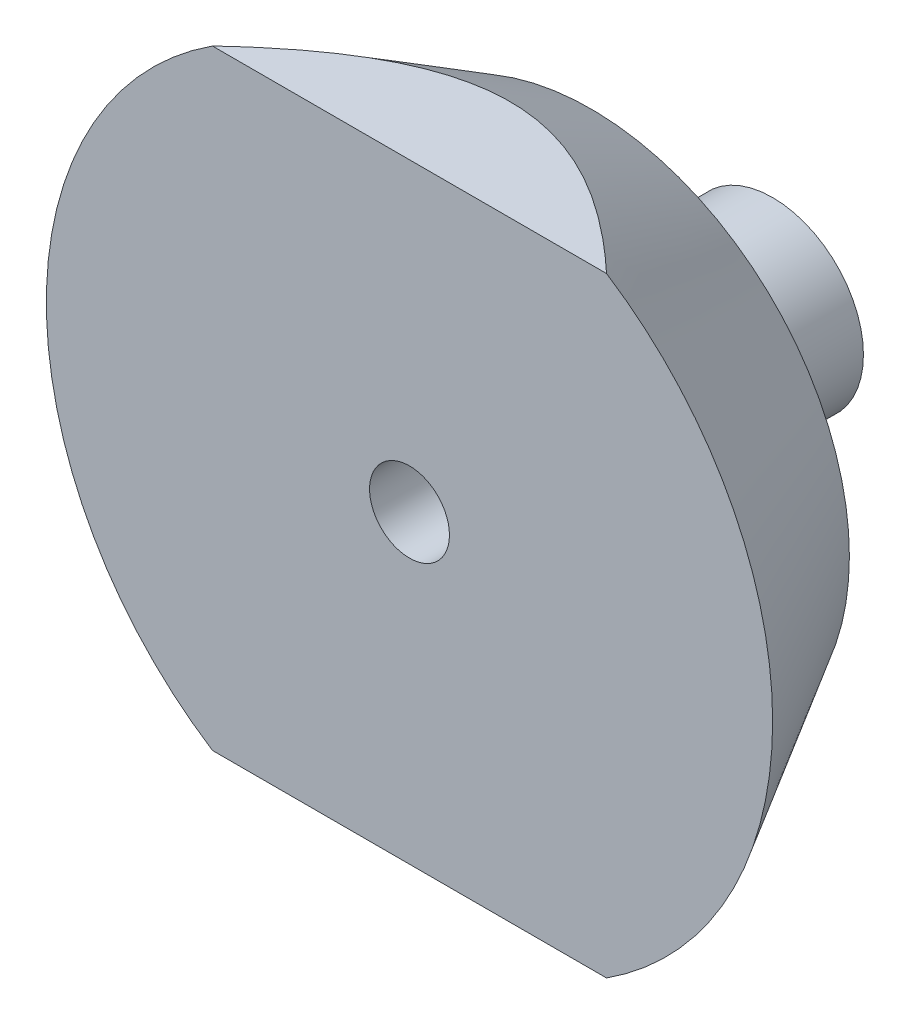
from build123d import *

# Parameters (mm, degrees)
SKETCH1_R                  = 50
EXTRUDE1_DEPTH             = 25
EXTRUDE1_DRAFT             = -30
SKETCH2_R                  = 12.5
EXTRUDE2_DEPTH             = 25
SKETCH3_R                  = 8
CUT_EXTRUDE1_DEPTH         = 16
F_11_0_11_DIAMETER_HOLE1_D = 11
CUT_EXTRUDE2_DEPTH         = 76


with BuildPart() as part:
    # Sketch1 → Extrude1 (with draft: the straight prism first)
    with BuildSketch(Plane.XY):
        Circle(SKETCH1_R)
    extrude(amount=-EXTRUDE1_DEPTH)
    # Extrude1: the draft: its side faces are tilted about the plane it starts from
    extrude1_sides = [part.faces().sort_by_distance(p)[0] for p in [
        (-50, 0, -12.5),
    ]]
    draft(extrude1_sides, Plane.XY, EXTRUDE1_DRAFT)

    # Sketch2 → Extrude2 (add)
    with BuildSketch(Plane(origin=(0, 0, -25), x_dir=(-1, 0, 0), z_dir=(0, 0, -1))):
        with Locations(Location((0, 0, 0), (0, 0, 180))):
            Circle(SKETCH2_R)
    extrude(amount=EXTRUDE2_DEPTH)

    # Sketch3 → Cut-Extrude1 (cut)
    with BuildSketch(Plane(origin=(0, 0, -50), x_dir=(-1, 0, 0), z_dir=(0, 0, -1))):
        Circle(SKETCH3_R)
    extrude(amount=-CUT_EXTRUDE1_DEPTH, mode=Mode.SUBTRACT)

    # Ø11.0 (11) Diameter Hole1 (through all)
    with Locations(Plane.XY):
        with Locations((0, 0)):
            Hole(F_11_0_11_DIAMETER_HOLE1_D / 2)

    # Sketch7 → Cut-Extrude2 (cut, through all)
    with BuildSketch(Plane(origin=(0, 0, -25), x_dir=(-1, 0, 0), z_dir=(0, 0, -1))):
        Polygon((-55, 42), (60, 42), (60, -42), (-55, -42), (-55, -67), (80, -67), (80, 67), (-55, 67), align=None)
    extrude(amount=-CUT_EXTRUDE2_DEPTH, mode=Mode.SUBTRACT)


solid = part.part
